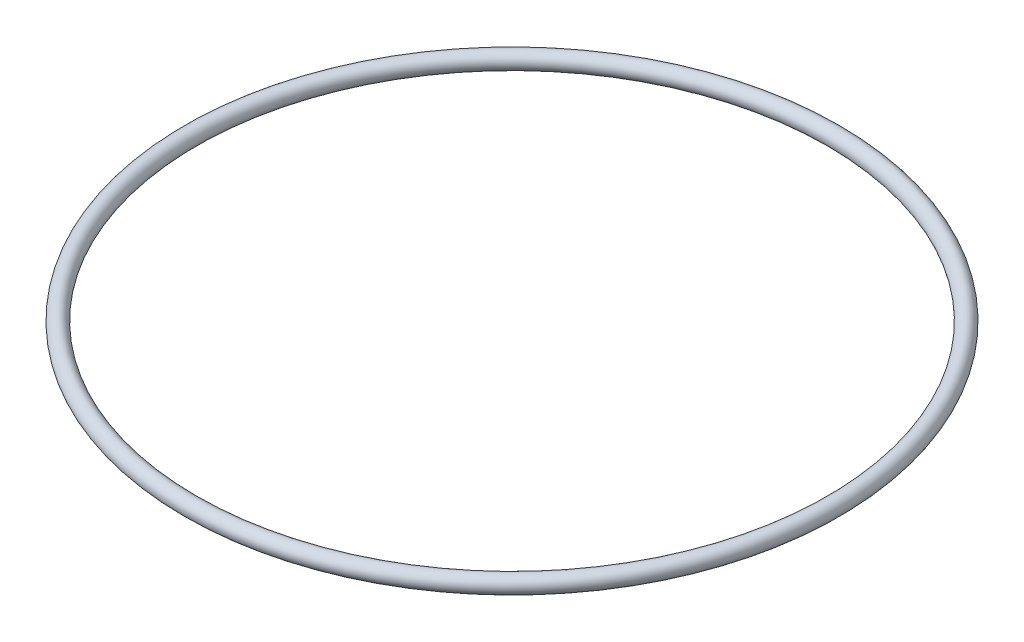
from build123d import *

# Parameters (mm, degrees)
SKETCH1_R = 0.89


with BuildPart() as part:
    # Sketch1 → Revolve1 (revolve)
    with BuildSketch(Plane.XY, mode=Mode.PRIVATE) as revolve1_sk:
        with Locations((34.145, 0)):
            Circle(SKETCH1_R)
    revolve(revolve1_sk.sketch.rotate(Axis((0, -4.868377982, 0), (0, 1, 0)), 90), axis=Axis((0, -4.868377982, 0), (0, 1, 0)))


solid = part.part
